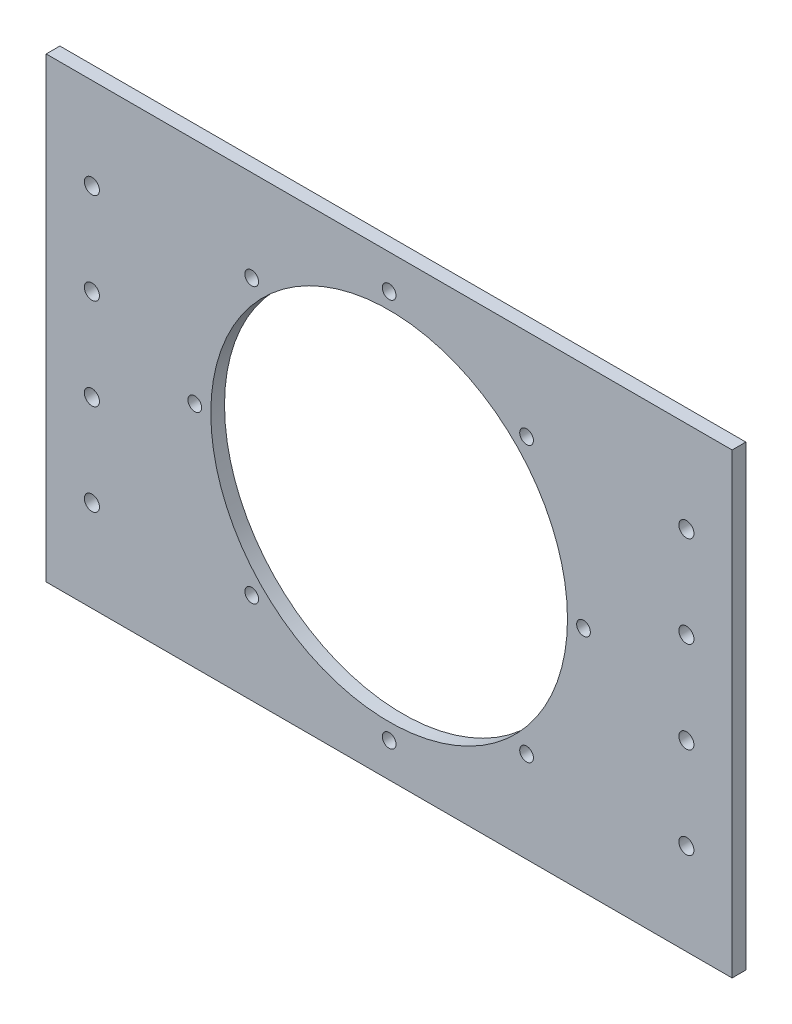
from build123d import *

# Parameters (mm, degrees)
SKETCH_1_W      = 150
SKETCH_1_H      = 100
SKETCH_1_R      = 39
SKETCH_1_R_2    = 1.5
SKETCH_1_R_3    = 1.65
EXTRUDE_1_DEPTH = 3


with BuildPart() as part:
    # 草图1 → 凸台-拉伸1 (new body)
    with BuildSketch(Plane.XY):
        Rectangle(SKETCH_1_W, SKETCH_1_H)
        Circle(SKETCH_1_R, mode=Mode.SUBTRACT)
        with Locations((42.5, 0)):
            Circle(SKETCH_1_R_2, mode=Mode.SUBTRACT)
        with Locations((30.0520382, -30.0520382)):
            Circle(SKETCH_1_R_2, mode=Mode.SUBTRACT)
        with Locations((0, -42.5)):
            Circle(SKETCH_1_R_2, mode=Mode.SUBTRACT)
        with Locations((-30.0520382, -30.0520382)):
            Circle(SKETCH_1_R_2, mode=Mode.SUBTRACT)
        with Locations((-42.5, 0)):
            Circle(SKETCH_1_R_2, mode=Mode.SUBTRACT)
        with Locations((-30.0520382, 30.0520382)):
            Circle(SKETCH_1_R_2, mode=Mode.SUBTRACT)
        with Locations((0, 42.5)):
            Circle(SKETCH_1_R_2, mode=Mode.SUBTRACT)
        with Locations((30.0520382, 30.0520382)):
            Circle(SKETCH_1_R_2, mode=Mode.SUBTRACT)
        with Locations((-65, 30)):
            Circle(SKETCH_1_R_3, mode=Mode.SUBTRACT)
        with Locations((-65, 10)):
            Circle(SKETCH_1_R_3, mode=Mode.SUBTRACT)
        with Locations((-65, -10)):
            Circle(SKETCH_1_R_3, mode=Mode.SUBTRACT)
        with Locations((-65, -30)):
            Circle(SKETCH_1_R_3, mode=Mode.SUBTRACT)
        with Locations(Location((65, -30, 0), (0, 0, 180))):
            Circle(SKETCH_1_R_3, mode=Mode.SUBTRACT)
        with Locations(Location((65, -10, 0), (0, 0, 180))):
            Circle(SKETCH_1_R_3, mode=Mode.SUBTRACT)
        with Locations(Location((65, 10, 0), (0, 0, 180))):
            Circle(SKETCH_1_R_3, mode=Mode.SUBTRACT)
        with Locations(Location((65, 30, 0), (0, 0, 180))):
            Circle(SKETCH_1_R_3, mode=Mode.SUBTRACT)
    extrude(amount=EXTRUDE_1_DEPTH)


solid = part.part
